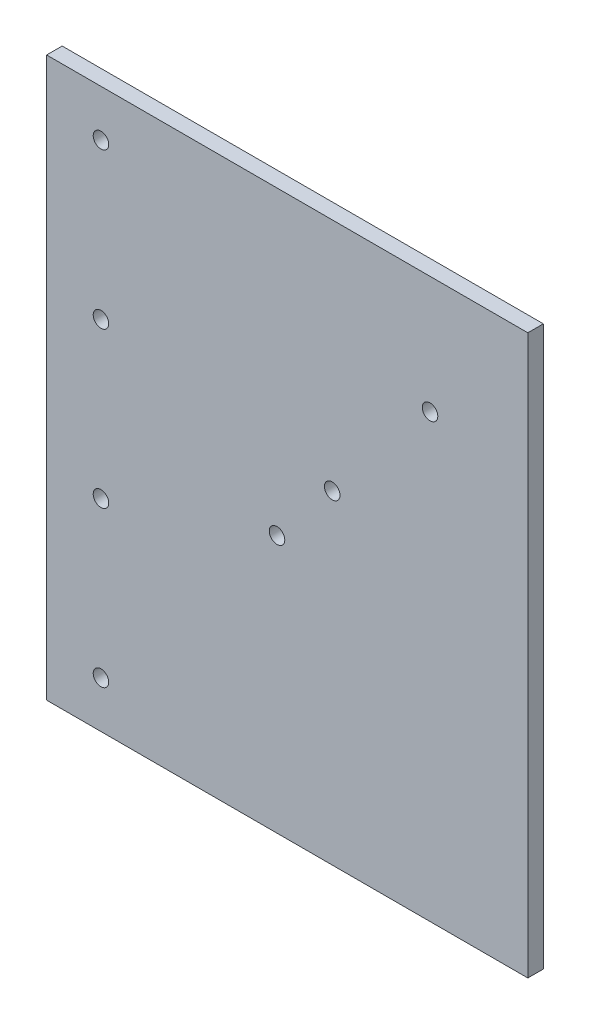
from build123d import *

# Parameters (mm, degrees)
SKETCH1_W             = 393.7
SKETCH1_H             = 457.2
PLATE_DEPTH           = 12.7
STANDARD_LINEAR_COUNT = 4
STANDARD_LINEAR_PITCH = 127


with BuildPart() as part:
    # Sketch1 → Plate (new body)
    with BuildSketch(Plane.XY):
        with Locations((196.85, 228.6)):
            Rectangle(SKETCH1_W, SKETCH1_H)
    extrude(amount=PLATE_DEPTH)

    # Sketch3 → Hole (revolve, cut)
    with BuildSketch(Plane(origin=(44.45, 38.1, 12.7), x_dir=(0, -1, 0), z_dir=(1, 0, 0))):
        Polygon((0, 0), (0, 29.215464931), (6.35, 25.4), (6.35, 0), align=None)
    hole = revolve(axis=Axis((44.45, 38.1, 19.05), (0, 0, -1)), mode=Mode.SUBTRACT)

    # Standard Linear: Hole ×4
    with Locations(*[(0, i * STANDARD_LINEAR_PITCH, 0) for i in range(1, STANDARD_LINEAR_COUNT)]):
        add(hole, mode=Mode.SUBTRACT)

    # Sketch-Pattern1: Hole at 3 more places
    with Locations((189.2039, 227.04468, 0), (269.22695, 323.07234, 0), (144.04149, 172.849788, 0)):
        add(hole, mode=Mode.SUBTRACT)


solid = part.part
